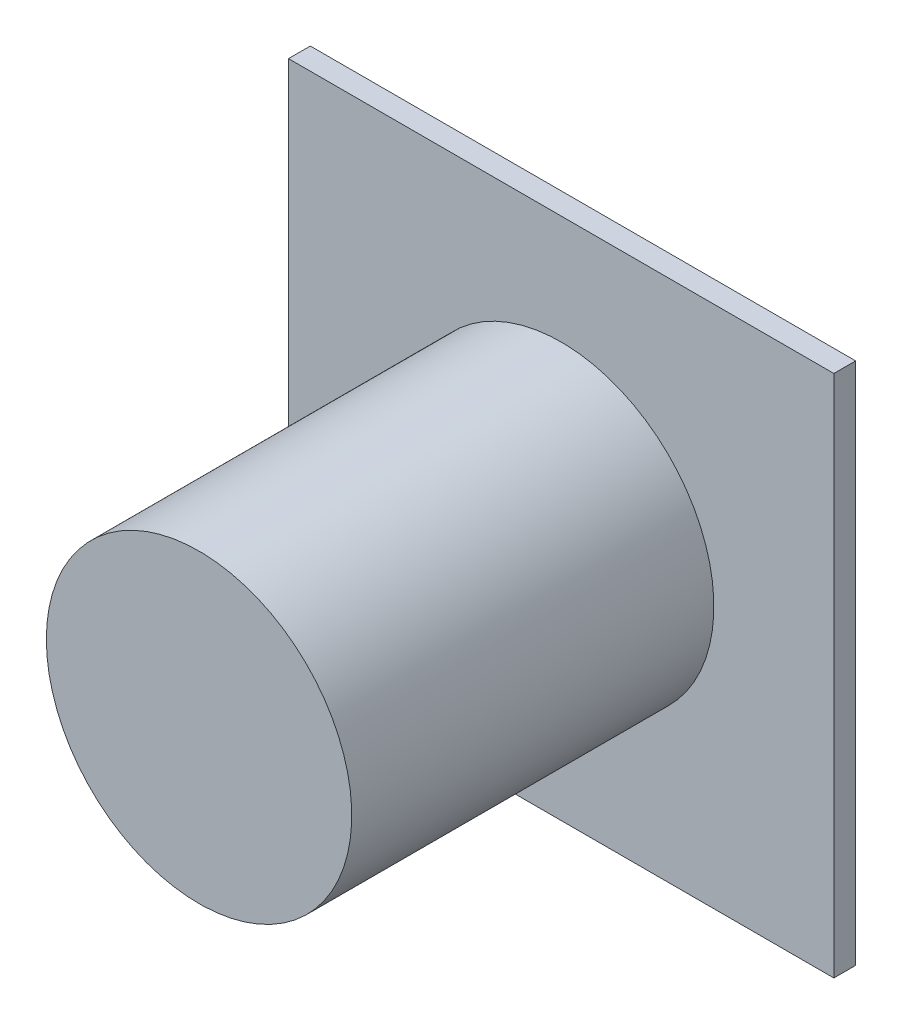
from build123d import *

# Parameters (mm, degrees)
SKETCH_1_W       = 25
SKETCH_1_H       = 24
F_25X24PCB_DEPTH = 1
F_14MM_START     = 1
SKETCH_2_R       = 7
F_14MM_DEPTH     = 16.6


with BuildPart() as part:
    # 草图1 → 25x24PCB示意 (new body)
    with BuildSketch(Plane.XY):
        Rectangle(SKETCH_1_W, SKETCH_1_H)
    extrude(amount=F_25X24PCB_DEPTH)

    # 草图2 → 14mm镜头前端外形示意 (add)
    with BuildSketch(Plane.XY.offset(F_14MM_START)):
        with Locations(Location((0, 0, 0), (0, 0, 180))):
            Circle(SKETCH_2_R)
    extrude(amount=F_14MM_DEPTH)


solid = part.part
